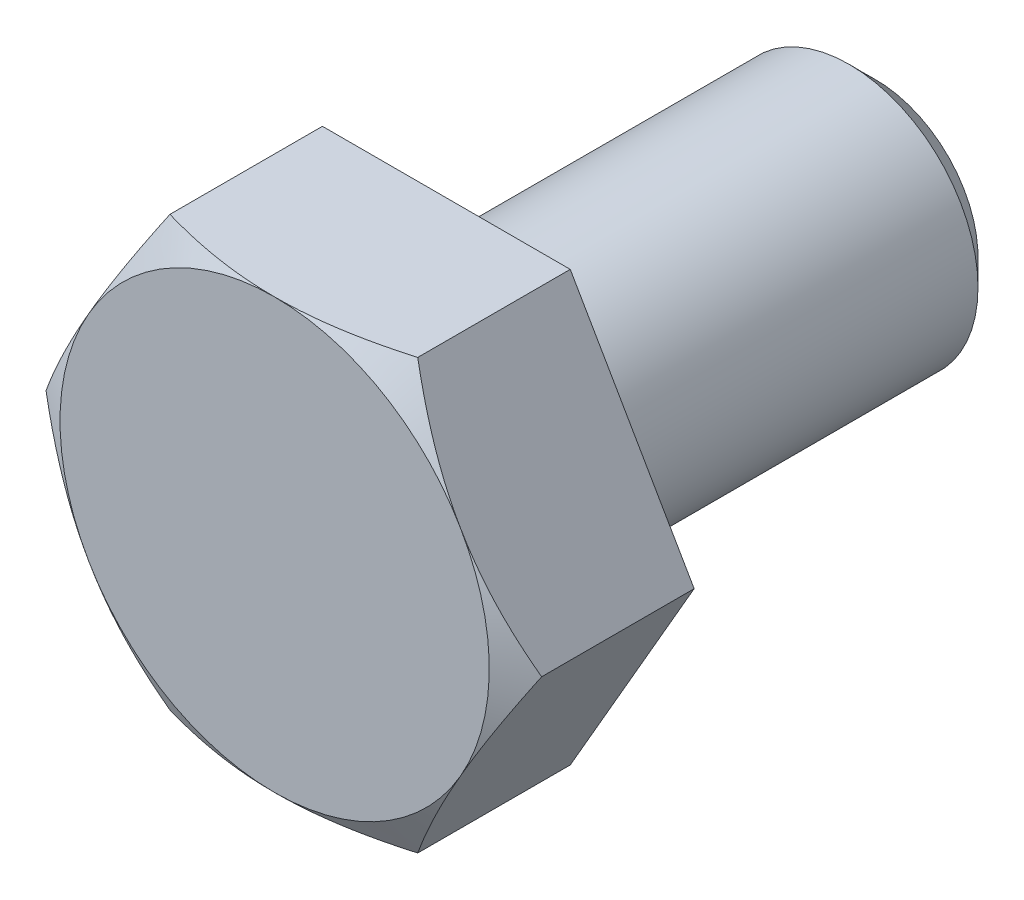
from build123d import *

# Parameters (mm, degrees)
BASE_EXTRUDE_DEPTH  = 4
SKETCH3_R           = 3
BOSS_EXTRUDE1_DEPTH = 10
CHAMFER1_SIZE       = 0.6134
FILLET1_R           = 0.25


with BuildPart() as part:
    # Sketch1 → Base-Extrude (new body)
    with BuildSketch(Plane.XY):
        Polygon((-2.886751346, 5), (2.886751346, 5), (5.773502692, 0), (2.886751346, -5), (-2.886751346, -5), (-5.773502692, 0), align=None)
    extrude(amount=BASE_EXTRUDE_DEPTH)

    # Sketch5 → Cut-Revolve1 (revolve, cut)
    with BuildSketch(Plane(origin=(0, 0, 0), x_dir=(1, 0, 0), z_dir=(0, 1, 0))):
        Polygon((-5.773502692, -4), (-5, -4), (-5.773502692, -3.553418013), align=None)
    revolve(axis=Axis((0, 0, 0), (0, 0, 1)), mode=Mode.SUBTRACT)

    # Sketch3 → Boss-Extrude1 (add)
    with BuildSketch(Plane(origin=(0, 0, 0), x_dir=(-1, 0, 0), z_dir=(0, 0, -1))):
        with Locations(Location((0, 0, 0), (0, 0, 180))):
            Circle(SKETCH3_R)
    extrude(amount=BOSS_EXTRUDE1_DEPTH)

    # Chamfer1
    chamfer1_edges = [part.edges().sort_by_distance(p)[0] for p in [
        (-3, 0, -10),
    ]]
    chamfer(chamfer1_edges, length=CHAMFER1_SIZE)

    # Fillet1
    fillet1_edges = [part.edges().sort_by_distance(p)[0] for p in [
        (-3, 0, 0),
    ]]
    fillet(fillet1_edges, radius=FILLET1_R)


solid = part.part
